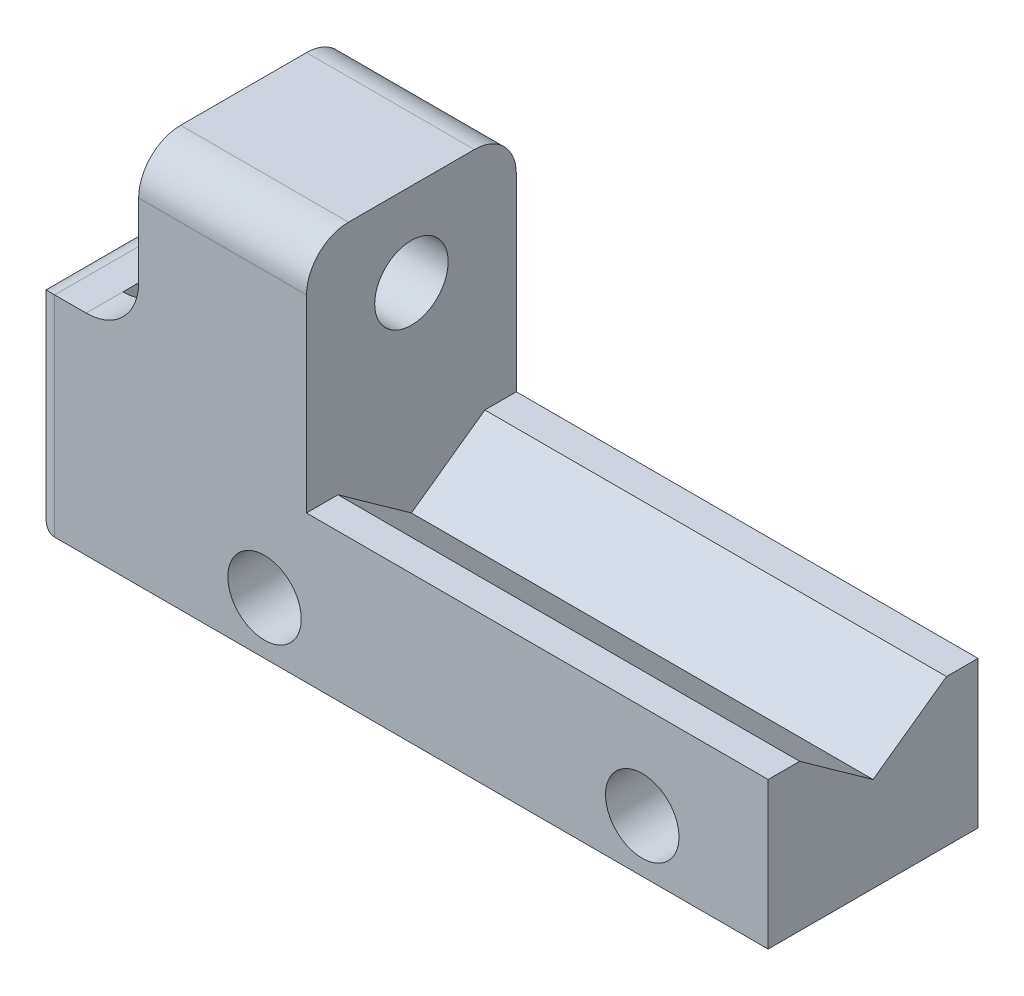
from build123d import *

# Parameters (mm, degrees)
SKETCH_1_W           = 27
SKETCH_1_H           = 9
EXTRUDE_1_DEPTH      = 10
SKETCH_4_W           = 5
SKETCH_4_H           = 10
EXTRUDE_4_DEPTH      = 6
SKETCH_5_W           = 22
SKETCH_5_H           = 10
CUT_EXTRUDE_1_DEPTH  = 2
CUT_EXTRUDE_2_DEPTH  = 22
FILLET_1_R           = 1
FILLET_2_R           = 1
SKETCH_8_W           = 10
SKETCH_8_H           = 20
EXTRUDE_5_DEPTH      = 8
FILLET_3_R           = 2
FILLET_4_R           = 2
EXTRUDE_6_DEPTH      = 3
SKETCH_11_W          = 10
SKETCH_11_H          = 2.149089289
CUT_EXTRUDE_5_DEPTH  = 29.70975444
FILLET_5_R           = 2
FILLET_6_R           = 2
SKETCH_14_R          = 1.5
CUT_EXTRUDE_6_DEPTH  = 24.547823679
SKETCH_15_R          = 1.5
EXTRUDE_7_DEPTH      = 10
SKETCH_18_R          = 1.5
EXTRUDE_9_DEPTH      = 10
SKETCH_17_R          = 1.5
CUT_EXTRUDE_7_DEPTH  = 24.547823679
SKETCH_19_R          = 1.5
CUT_EXTRUDE_8_DEPTH  = 24.547823679
CUT_EXTRUDE_9_DEPTH  = 22
SKETCH_23_W          = 10
SKETCH_23_H          = 10
EXTRUDE_10_DEPTH     = 5
SKETCH_24_W          = 3.25
SKETCH_24_H          = 1.25
CUT_EXTRUDE_11_DEPTH = 4
CUT_EXTRUDE_12_DEPTH = 6.25
FILLET_7_R           = 2.5
FILLET_8_R           = 1
SKETCH_26_R          = 1.5
CUT_EXTRUDE_13_DEPTH = 35.383862494
SKETCH_27_R          = 1.75
CUT_EXTRUDE_14_DEPTH = 25.989997999
SKETCH_28_R          = 1.75
CUT_EXTRUDE_15_DEPTH = 35.383862494


with BuildPart() as part:
    # Эскиз1 → Бобышка-Вытянуть1 (new body)
    with BuildSketch(Plane.XY):
        Rectangle(SKETCH_1_W, SKETCH_1_H)
    extrude(amount=EXTRUDE_1_DEPTH)

    # Эскиз4 → Бобышка-Вытянуть4 (add)
    with BuildSketch(Plane(origin=(0, 4.5, 0), x_dir=(1, 0, 0), z_dir=(0, 1, 0))):
        with Locations((-11, -5)):
            Rectangle(SKETCH_4_W, SKETCH_4_H)
    extrude(amount=EXTRUDE_4_DEPTH)

    # Эскиз5 → Вырез-Вытянуть1 (cut)
    with BuildSketch(Plane(origin=(0, 4.5, 0), x_dir=(1, 0, 0), z_dir=(0, 1, 0))):
        with Locations((2.5, -5)):
            Rectangle(SKETCH_5_W, SKETCH_5_H)
    extrude(amount=-CUT_EXTRUDE_1_DEPTH, mode=Mode.SUBTRACT)

    # Эскиз6 → Вырез-Вытянуть2 (cut)
    with BuildSketch(Plane(origin=(13.5, 0, 0), x_dir=(0, 0, -1), z_dir=(1, 0, 0))):
        Polygon((-1.5, 2.5), (-8.5, 2.5), (-5, 0), align=None)
    extrude(amount=-CUT_EXTRUDE_2_DEPTH, mode=Mode.SUBTRACT)

    # Скругление1
    fillet_1_edges = [part.edges().sort_by_distance(p)[0] for p in [
        (-11, 10.5, 10),
    ]]
    fillet(fillet_1_edges, radius=FILLET_1_R)

    # Скругление2
    fillet_2_edges = [part.edges().sort_by_distance(p)[0] for p in [
        (-11, 10.5, 0),
    ]]
    fillet(fillet_2_edges, radius=FILLET_2_R)

    # Эскиз8 → Бобышка-Вытянуть5 (add)
    with BuildSketch(Plane.ZY.offset(13.5)):
        with Locations((5, 5.5)):
            Rectangle(SKETCH_8_W, SKETCH_8_H)
    extrude(amount=-EXTRUDE_5_DEPTH)

    # Скругление3
    fillet_3_edges = [part.edges().sort_by_distance(p)[0] for p in [
        (-9.5, 15.5, 10),
    ]]
    fillet(fillet_3_edges, radius=FILLET_3_R)

    # Скругление4
    fillet_4_edges = [part.edges().sort_by_distance(p)[0] for p in [
        (-9.5, 15.5, 0),
    ]]
    fillet(fillet_4_edges, radius=FILLET_4_R)

    # Эскиз9 → Бобышка-Вытянуть6 (add)
    with BuildSketch(Plane(origin=(13.5, 0, 0), x_dir=(0, 0, -1), z_dir=(1, 0, 0))):
        Polygon((-10, -4.5), (-10, 2.5), (-8.5, 2.5), (-5, 0), (-1.5, 2.5), (0, 2.5), (0, -4.5), align=None)
    extrude(amount=EXTRUDE_6_DEPTH)

    # Эскиз11 → Вырез-Вытянуть5 (cut, through all)
    with BuildSketch(Plane(origin=(-5.5, 0, 0), x_dir=(0, 0, -1), z_dir=(1, 0, 0))):
        with Locations((-5, 14.574544645)):
            Rectangle(SKETCH_11_W, SKETCH_11_H)
    extrude(amount=-CUT_EXTRUDE_5_DEPTH, mode=Mode.SUBTRACT)

    # Скругление5
    fillet_5_edges = [part.edges().sort_by_distance(p)[0] for p in [
        (-9.5, 13.5, 10),
    ]]
    fillet(fillet_5_edges, radius=FILLET_5_R)

    # Скругление6
    fillet_6_edges = [part.edges().sort_by_distance(p)[0] for p in [
        (-9.5, 13.5, 0),
    ]]
    fillet(fillet_6_edges, radius=FILLET_6_R)

    # Эскиз14 → Вырез-Вытянуть6 (cut, through all)
    with BuildSketch(Plane.XY.offset(10)):
        with Locations((-7.5, -1)):
            Circle(SKETCH_14_R)
        with Locations((10.5, -1)):
            Circle(SKETCH_14_R)
    extrude(amount=-CUT_EXTRUDE_6_DEPTH, mode=Mode.SUBTRACT)

    # Эскиз15 → Бобышка-Вытянуть7 (add, through all)
    with BuildSketch(Plane.XY.offset(10)):
        with Locations((10.5, -1)):
            Circle(SKETCH_15_R)
    extrude(amount=-EXTRUDE_7_DEPTH)

    # Эскиз18 → Бобышка-Вытянуть9 (add, through all)
    with BuildSketch(Plane.XY.offset(10)):
        with Locations((-7.5, -1)):
            Circle(SKETCH_18_R)
    extrude(amount=-EXTRUDE_9_DEPTH)

    # Эскиз17 → Вырез-Вытянуть7 (cut, through all)
    with BuildSketch(Plane.XY.offset(10)):
        with Locations((-7.5, -2)):
            Circle(SKETCH_17_R)
    extrude(amount=-CUT_EXTRUDE_7_DEPTH, mode=Mode.SUBTRACT)

    # Эскиз19 → Вырез-Вытянуть8 (cut, through all)
    with BuildSketch(Plane.XY.offset(10)):
        with Locations((10.5, -2)):
            Circle(SKETCH_19_R)
    extrude(amount=-CUT_EXTRUDE_8_DEPTH, mode=Mode.SUBTRACT)

    # Эскиз20 → Вырез-Вытянуть9 (cut)
    with BuildSketch(Plane(origin=(16.5, 0, 0), x_dir=(0, 0, -1), z_dir=(1, 0, 0))):
        Polygon((-8.5, 2.5), (-5, 0), (-1.5, 2.5), align=None)
    extrude(amount=-CUT_EXTRUDE_9_DEPTH, mode=Mode.SUBTRACT)

    # Эскиз23 → Бобышка-Вытянуть10 (add)
    with BuildSketch(Plane.ZY.offset(13.5)):
        with Locations((5, 0.5)):
            Rectangle(SKETCH_23_W, SKETCH_23_H)
    extrude(amount=EXTRUDE_10_DEPTH)

    # Эскиз24 → Вырез-Вытянуть11 (cut)
    with BuildSketch(Plane.ZY.offset(18.5)):
        with Locations((3.375, 1.125)):
            Rectangle(SKETCH_24_W, SKETCH_24_H)
        with Locations((6.625, 1.125)):
            Rectangle(SKETCH_24_W, SKETCH_24_H)
        with Locations((3.375, -0.125)):
            Rectangle(SKETCH_24_W, SKETCH_24_H)
        with Locations((6.625, -0.125)):
            Rectangle(SKETCH_24_W, SKETCH_24_H)
    extrude(amount=-CUT_EXTRUDE_11_DEPTH, mode=Mode.SUBTRACT)

    # Эскиз25 → Вырез-Вытянуть12 (cut)
    with BuildSketch(Plane(origin=(0, 5.5, 0), x_dir=(1, 0, 0), z_dir=(0, 1, 0))):
        Polygon((-13.5, -5), (-13.5, -1.75), (-16, -1.75), (-16, -8.25), (-13.5, -8.25), align=None)
    extrude(amount=-CUT_EXTRUDE_12_DEPTH, mode=Mode.SUBTRACT)

    # Скругление7
    fillet_7_edges = [part.edges().sort_by_distance(p)[0] for p in [
        (-13.5, 5.5, 9.125),
        (-13.5, 5.5, 0.875),
    ]]
    fillet(fillet_7_edges, radius=FILLET_7_R)

    # Скругление8
    fillet_8_edges = [part.edges().sort_by_distance(p)[0] for p in [
        (-18.5, 0.5, 0),
        (-18.5, -4.5, 5),
        (-18.5, 0.5, 10),
        (-18.5, 5.5, 5),
    ]]
    fillet(fillet_8_edges, radius=FILLET_8_R)

    # Эскиз26 → Вырез-Вытянуть13 (cut, through all)
    with BuildSketch(Plane.ZY.offset(13.5)):
        with Locations((5, 9.5)):
            Circle(SKETCH_26_R)
    extrude(amount=-CUT_EXTRUDE_13_DEPTH, mode=Mode.SUBTRACT)

    # Эскиз27 → Вырез-Вытянуть14 (cut, through all)
    with BuildSketch(Plane(origin=(0, 0, 0), x_dir=(-1, 0, 0), z_dir=(0, 0, -1))):
        with Locations((-10.5, -2)):
            Circle(SKETCH_27_R)
        with Locations((7.5, -2)):
            Circle(SKETCH_27_R)
    extrude(amount=-CUT_EXTRUDE_14_DEPTH, mode=Mode.SUBTRACT)

    # Эскиз28 → Вырез-Вытянуть15 (cut, through all)
    with BuildSketch(Plane.ZY.offset(13.5)):
        with Locations((5, 9.5)):
            Circle(SKETCH_28_R)
    extrude(amount=-CUT_EXTRUDE_15_DEPTH, mode=Mode.SUBTRACT)


solid = part.part
